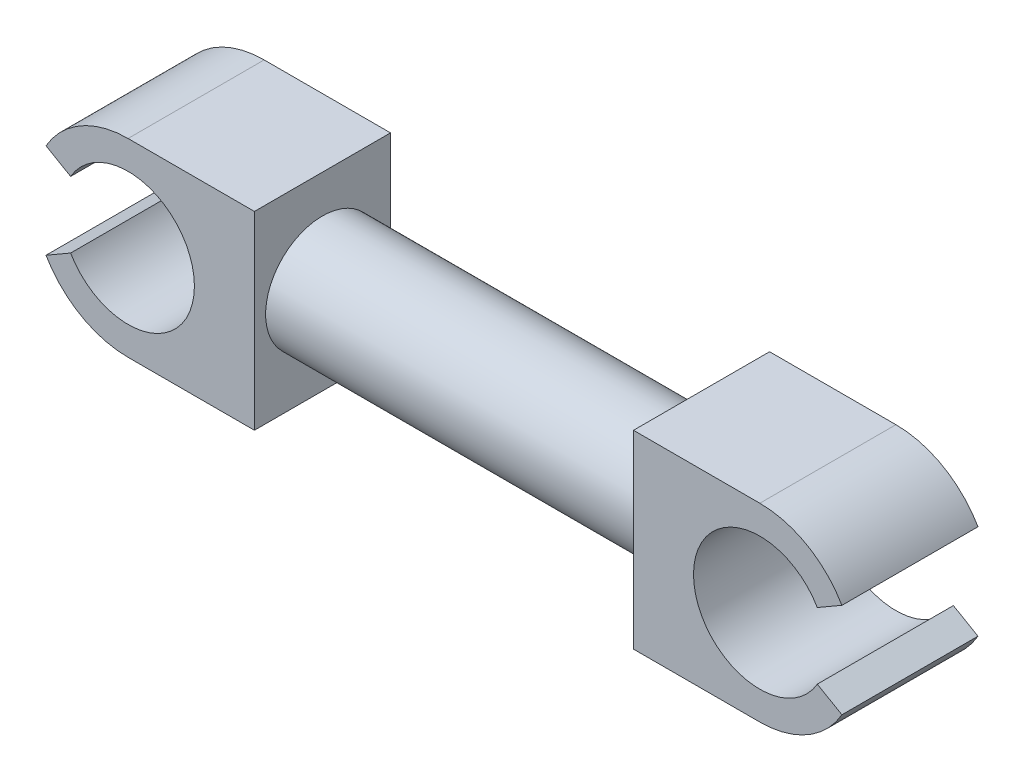
from build123d import *

# Parameters (mm, degrees)
ESTRUSIONE_ESTRUSIONE1_DEPTH = 21.54
SCHIZZO2_W                   = 21.54
SCHIZZO2_H                   = 30
SCHIZZO2_R                   = 9
TAGLIO_ESTRUSIONE1_DEPTH     = 60


with BuildPart() as part:
    # Schizzo1 → Estrusione-Estrusione1 (new body)
    with BuildSketch(Plane.XY):
        with BuildLine():
            Line((0, 15), (100, 15))
            ThreePointArc((100, 15), (107.5, 12.990381057), (112.990381057, 7.5))
            Line((112.990381057, 7.5), (109.09326674, 5.25))
            ThreePointArc((109.09326674, 5.25), (89.5, 0), (109.09326674, -5.25))
            Line((109.09326674, -5.25), (112.990381057, -7.5))
            ThreePointArc((112.990381057, -7.5), (107.5, -12.990381057), (100, -15))
            Line((100, -15), (0, -15))
            ThreePointArc((0, -15), (-7.5, -12.990381057), (-12.990381057, -7.5))
            Line((-12.990381057, -7.5), (-9.09326674, -5.25))
            ThreePointArc((-9.09326674, -5.25), (10.5, 0), (-9.09326674, 5.25))
            Line((-9.09326674, 5.25), (-12.990381057, 7.5))
            ThreePointArc((-12.990381057, 7.5), (-7.5, 12.990381057), (0, 15))
        make_face()
    extrude(amount=ESTRUSIONE_ESTRUSIONE1_DEPTH)

    # Schizzo2 → Taglio-Estrusione1 (cut)
    with BuildSketch(Plane(origin=(20, 0, 0), x_dir=(0, 0, -1), z_dir=(1, 0, 0))):
        with Locations((-10.77, 0)):
            Rectangle(SCHIZZO2_W, SCHIZZO2_H)
        with Locations((-10.77, 0)):
            Circle(SCHIZZO2_R, mode=Mode.SUBTRACT)
    extrude(amount=TAGLIO_ESTRUSIONE1_DEPTH, mode=Mode.SUBTRACT)


solid = part.part
